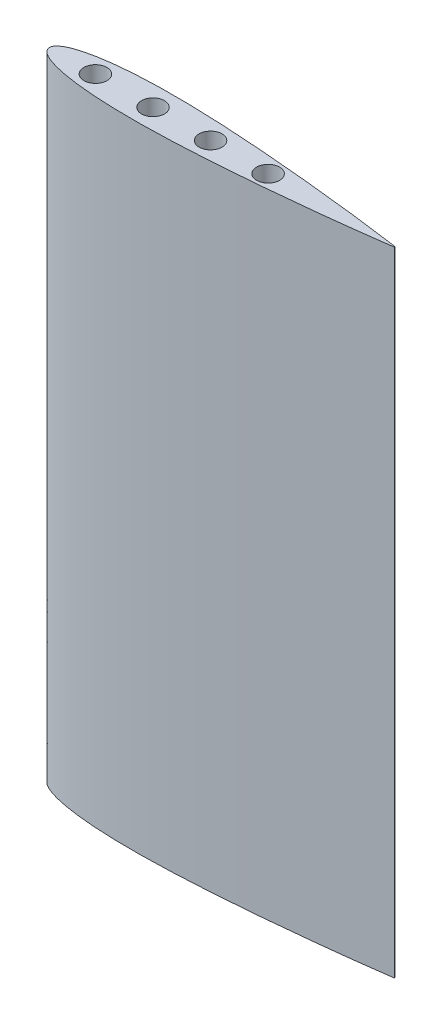
from build123d import *

# Parameters (mm, degrees)
BOSS_EXTRUDE1_DEPTH = 69.85
SKETCH5_R           = 1.27
CUT_EXTRUDE1_DEPTH  = 12.7


with BuildPart() as part:
    # Sketch4 → Boss-Extrude1 (new body)
    with BuildSketch(Plane(origin=(0, 0, 0), x_dir=(1, 0, 0), z_dir=(0, 1, 0))):
        with BuildLine():
            Line((38.1, 0.048006), (38.1, -0.048006))
            add(Edge.make_bspline(
                [(38.1, -0.048006), (38.092583251, -0.049047765), (38.062942912, -0.053211081), (37.944647253, -0.069755857), (37.767562125, -0.094486743), (37.532052521, -0.126965392), (37.290396557, -0.160190201), (37.006127116, -0.198904989), (36.679917937, -0.242859006), (36.312541545, -0.291864294), (35.904851816, -0.345569023), (35.45779868, -0.403720926), (34.972416984, -0.465853222), (34.252060102, -0.55677244), (33.484541596, -0.651127112), (32.671637318, -0.748448048), (32.013353772, -0.825737809), (31.324771293, -0.904853153), (30.607537282, -0.985592031), (29.863304352, -1.067375261), (29.093834288, -1.14998319), (28.300894079, -1.232825488), (27.486352847, -1.315748636), (26.652102975, -1.398113207), (25.80010602, -1.479660513), (24.932340473, -1.559824173), (24.050830619, -1.638342101), (23.157640656, -1.714565201), (22.254852072, -1.788152536), (21.344584786, -1.858634165), (20.428953151, -1.925444296), (19.510108942, -1.988163902), (18.590197069, -2.046291991), (17.367880801, -2.116763144), (16.151069434, -2.176215597), (14.648712156, -2.234066929), (13.465971548, -2.266645454), (12.300091132, -2.283584551), (11.448035029, -2.288048273), (10.613726655, -2.284102235), (9.799118606, -2.271569022), (9.00611977, -2.250069868), (8.236564553, -2.21969991), (7.49224861, -2.180240934), (6.774904805, -2.131803537), (6.086222319, -2.074397819), (5.427802298, -2.008128116), (4.801174603, -1.933245819), (4.207783855, -1.850055304), (3.649027942, -1.758711647), (3.126187427, -1.659671366), (2.640465618, -1.55330687), (2.192997688, -1.439978722), (1.7847724, -1.320194614), (1.416689892, -1.194352348), (1.089535118, -1.062886557), (0.803955697, -0.926176493), (0.560495695, -0.784506781), (0.35943861, -0.638117579), (0.20117294, -0.486768084), (0.086080347, -0.330029549), (0.015712554, -0.167135854), (-0.007658957, 0), (0.015712554, 0.167135854), (0.086080347, 0.330029549), (0.20117294, 0.486768084), (0.35943861, 0.638117579), (0.560495695, 0.784506781), (0.803955697, 0.926176493), (1.089535118, 1.062886557), (1.416689892, 1.194352348), (1.7847724, 1.320194614), (2.192997688, 1.439978722), (2.640465618, 1.55330687), (3.126187427, 1.659671366), (3.649027942, 1.758711647), (4.207783855, 1.850055304), (4.801174603, 1.933245819), (5.427802298, 2.008128116), (6.086222319, 2.074397819), (6.774904805, 2.131803537), (7.49224861, 2.180240934), (8.236564553, 2.21969991), (9.00611977, 2.250069868), (9.799118606, 2.271569022), (10.613726655, 2.284102235), (11.448035029, 2.288048273), (12.300091132, 2.283584551), (13.465971548, 2.266645454), (14.952575769, 2.225697023), (16.454732583, 2.162253193), (17.671346838, 2.09926718), (18.590197069, 2.046291991), (19.510108942, 1.988163902), (20.428953151, 1.925444296), (21.344584786, 1.858634165), (22.254852072, 1.788152536), (23.157640656, 1.714565201), (24.050830619, 1.638342101), (24.932340473, 1.559824173), (25.80010602, 1.479660513), (26.652102975, 1.398113207), (27.486352847, 1.315748636), (28.300894079, 1.232825488), (29.093834288, 1.14998319), (29.863304352, 1.067375261), (30.607537282, 0.985592031), (31.324771293, 0.904853153), (32.013353772, 0.825737809), (32.671637318, 0.748448048), (33.484541596, 0.651127112), (34.252060102, 0.55677244), (34.972416984, 0.465853222), (35.45779868, 0.403720926), (35.904851816, 0.345569023), (36.312541545, 0.291864294), (36.679917937, 0.242859006), (37.006127116, 0.198904989), (37.290396557, 0.160190201), (37.532052521, 0.126965392), (37.767562125, 0.094486743), (37.944647253, 0.069755857), (38.062942912, 0.053211081), (38.092583251, 0.049047765), (38.1, 0.048006)],
                knots=[0, 0, 0, 0, 0.000289201, 0.001155766, 0.004612322, 0.007193518, 0.010335793, 0.014031397, 0.018271612, 0.023045847, 0.028342901, 0.03415012, 0.04045376, 0.04723833, 0.062186613, 0.070313724, 0.078851908, 0.087780126, 0.097077521, 0.106722049, 0.116690868, 0.126960505, 0.137507218, 0.148306055, 0.159330765, 0.17055649, 0.181956531, 0.193504043, 0.205171367, 0.2169323, 0.228758169, 0.2406214, 0.252494936, 0.264350287, 0.287897994, 0.299535854, 0.322404759, 0.333584032, 0.344559266, 0.35530596, 0.365799778, 0.37601757, 0.3859373, 0.395537659, 0.404797976, 0.413698812, 0.422221441, 0.430349273, 0.438066019, 0.445356904, 0.452209372, 0.458611567, 0.464554044, 0.47002985, 0.475034902, 0.479569141, 0.483636857, 0.487250263, 0.490431338, 0.493218828, 0.495674086, 0.497891368, 0.5, 0.502108632, 0.504325914, 0.506781172, 0.509568662, 0.512749737, 0.516363143, 0.520430859, 0.524965098, 0.52997015, 0.535445956, 0.541388433, 0.547790628, 0.554643096, 0.561933981, 0.569650727, 0.577778559, 0.586301188, 0.595202024, 0.604462341, 0.6140627, 0.62398243, 0.634200222, 0.64469404, 0.655440734, 0.666415968, 0.677595241, 0.700464146, 0.723839427, 0.735649713, 0.747505064, 0.7593786, 0.771241831, 0.7830677, 0.794828633, 0.806495957, 0.818043469, 0.82944351, 0.840669235, 0.851693945, 0.862492782, 0.873039495, 0.883309132, 0.893277951, 0.902922479, 0.912219874, 0.921148092, 0.929686276, 0.937813387, 0.95276167, 0.95954624, 0.96584988, 0.971657099, 0.976954153, 0.981728388, 0.985968603, 0.989664207, 0.992806482, 0.995387678, 0.998844234, 0.999710799, 1, 1, 1, 1], degree=3))
        make_face()
    extrude(amount=BOSS_EXTRUDE1_DEPTH)

    # Sketch5 → Cut-Extrude1 (cut)
    with BuildSketch(Plane(origin=(0, 69.85, 0), x_dir=(1, 0, 0), z_dir=(0, 1, 0))):
        with Locations(Location((5.08, 0, 0), (0, 0, 270))):
            Circle(SKETCH5_R)
        with Locations(Location((11.43, 0, 0), (0, 0, 270))):
            Circle(SKETCH5_R)
        with Locations(Location((17.78, 0, 0), (0, 0, 270))):
            Circle(SKETCH5_R)
        with Locations(Location((24.13, 0, 0), (0, 0, 270))):
            Circle(SKETCH5_R)
    extrude(amount=-CUT_EXTRUDE1_DEPTH, mode=Mode.SUBTRACT)


solid = part.part
